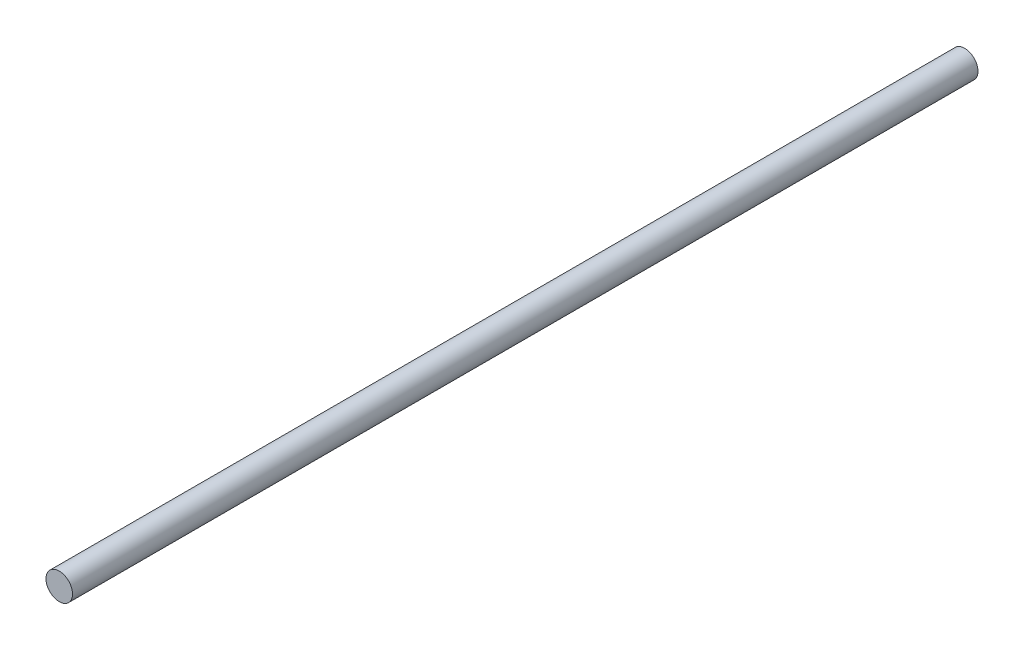
from build123d import *

# Parameters (mm, degrees)
SKETCH_1_R      = 3
EXTRUDE_1_DEPTH = 204.7


with BuildPart() as part:
    # 草图1 → 凸台-拉伸1 (new body)
    with BuildSketch(Plane.XY):
        Circle(SKETCH_1_R)
    extrude(amount=EXTRUDE_1_DEPTH)


solid = part.part
